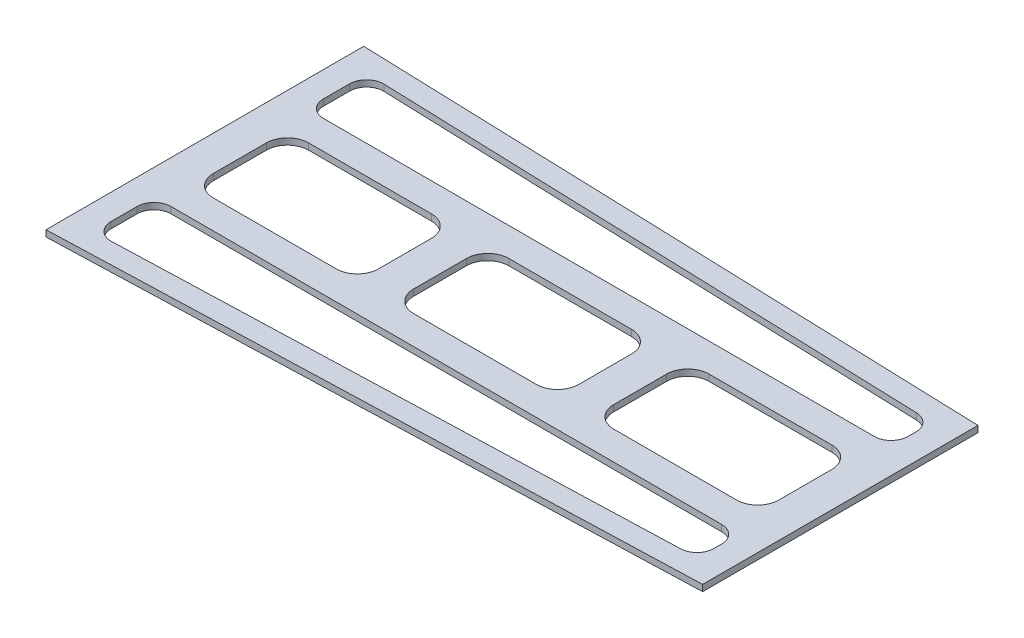
from build123d import *

# Parameters (mm, degrees)
BOSS_EXTRUDE1_DEPTH = 3
SKETCH2_W           = 78
SKETCH2_H           = 45
CUT_EXTRUDE1_DEPTH  = 10
FILLET1_R           = 10
CUT_EXTRUDE2_DEPTH  = 10


with BuildPart() as part:
    # Sketch1 → Boss-Extrude1 (new body)
    with BuildSketch(Plane(origin=(0, 0, 0), x_dir=(1, 0, 0), z_dir=(0, 1, 0))):
        Polygon((0, 0), (0, 75.000000004), (300, 65), (300, 0), align=None)
    boss_extrude1 = extrude(amount=BOSS_EXTRUDE1_DEPTH)

    # Mirror1: Boss-Extrude1 across Front Plane
    add(boss_extrude1.mirror(Plane.XY))

    # Sketch2 → Cut-Extrude1 (cut)
    with BuildSketch(Plane(origin=(0, 3, 0), x_dir=(1, 0, 0), z_dir=(0, 1, 0))):
        with Locations((55.5, 0)):
            Rectangle(SKETCH2_W, SKETCH2_H)
        with Locations((150, 0)):
            Rectangle(SKETCH2_W, SKETCH2_H)
        with Locations((244.5, 0)):
            Rectangle(SKETCH2_W, SKETCH2_H)
    extrude(amount=-CUT_EXTRUDE1_DEPTH, mode=Mode.SUBTRACT)

    # Fillet1
    fillet1_edges = [part.edges().sort_by_distance(p)[0] for p in [
        (16.5, 1.5, 22.5),
        (16.5, 1.5, -22.5),
        (94.5, 1.5, -22.5),
        (94.5, 1.5, 22.5),
        (111, 1.5, 22.5),
        (111, 1.5, -22.5),
        (189, 1.5, -22.5),
        (189, 1.5, 22.5),
        (205.5, 1.5, 22.5),
        (205.5, 1.5, -22.5),
        (283.5, 1.5, -22.5),
        (283.5, 1.5, 22.5),
    ]]
    fillet(fillet1_edges, radius=FILLET1_R)

    # Sketch3 → Cut-Extrude2 (cut)
    with BuildSketch(Plane(origin=(0, 3, 0), x_dir=(1, 0, 0), z_dir=(0, 1, 0))):
        with BuildLine():
            Line((12, 56.323336113), (12, 44))
            ThreePointArc((12, 44), (14.343145751, 38.343145751), (20, 36))
            Line((20, 36), (280, 36))
            ThreePointArc((280, 36), (285.656854249, 38.343145751), (288, 44))
            Line((288, 44), (288, 47.656669443))
            ThreePointArc((288, 47.656669443), (285.750310824, 53.218496969), (280.266518642, 55.652228699))
            Line((280.266518642, 55.652228699), (20.266518642, 64.318895369))
            ThreePointArc((20.266518642, 64.318895369), (14.438172474, 62.073646937), (12, 56.323336113))
        make_face()
    cut_extrude2 = extrude(amount=-CUT_EXTRUDE2_DEPTH, mode=Mode.SUBTRACT)

    # Mirror2: Cut-Extrude2 across plane
    add(cut_extrude2.mirror(Plane.XY), mode=Mode.SUBTRACT)


solid = part.part
